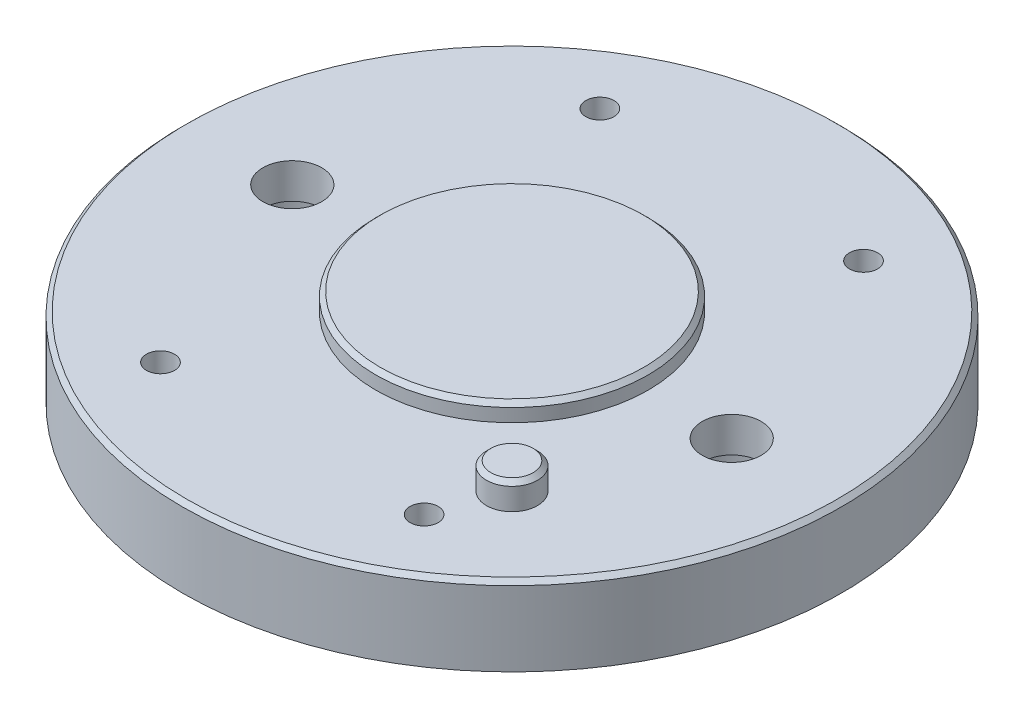
from build123d import *

# Parameters (mm, degrees)
SKIZZE1_R                       = 37.5
SKIZZE1_R_2                     = 3.25
AUFSATZ_LINEAR_AUSTRAGEN1_DEPTH = 9
BOHRUNG1_D                      = 6.7
BOHRUNG1_CBORE_D                = 11.1
BOHRUNG1_CBORE_DEPTH            = 5
SKIZZE3_R                       = 15.5
AUFSATZ_LINEAR_AUSTRAGEN2_DEPTH = 2
FASE1_SIZE                      = 0.5
SKIZZE7_R                       = 1.6
SCHNITT_LINEAR_AUSTRAGEN2_DEPTH = 55.161794653
FASE2_SIZE                      = 0.5
SKIZZE5_R                       = 2.9
AUFSATZ_LINEAR_AUSTRAGEN3_DEPTH = 3
FASE4_SIZE                      = 0.5


with BuildPart() as part:
    # Skizze1 → Aufsatz-Linear austragen1 (new body)
    with BuildSketch(Plane(origin=(0, 0, 0), x_dir=(1, 0, 0), z_dir=(0, 1, 0))):
        with Locations(Location((0, 0, 0), (0, 0, 270))):
            Circle(SKIZZE1_R)
        with Locations(Location((-25, 0, 0), (0, 0, 270))):
            Circle(SKIZZE1_R_2, mode=Mode.SUBTRACT)
        with Locations(Location((25, 0, 0), (0, 0, 270))):
            Circle(SKIZZE1_R_2, mode=Mode.SUBTRACT)
    extrude(amount=AUFSATZ_LINEAR_AUSTRAGEN1_DEPTH)

    # Bohrung1 (through all)
    with Locations(Plane(origin=(25, 0, 0), x_dir=(0, 0, -1), z_dir=(0, -1, 0))):
        with Locations((0, 0), (0, -50)):
            CounterBoreHole(BOHRUNG1_D / 2, BOHRUNG1_CBORE_D / 2, BOHRUNG1_CBORE_DEPTH)

    # Skizze3 → Aufsatz-Linear austragen2 (add)
    with BuildSketch(Plane(origin=(0, 9, 0), x_dir=(-1, 0, 0), z_dir=(0, 1, 0))):
        with Locations(Location((0, 0, 0), (0, 0, 90))):
            Circle(SKIZZE3_R)
    extrude(amount=AUFSATZ_LINEAR_AUSTRAGEN2_DEPTH)

    # Fase1
    fase1_edges = [part.edges().sort_by_distance(p)[0] for p in [
        (0, 11, -15.5),
    ]]
    chamfer(fase1_edges, length=FASE1_SIZE)

    # Skizze7 → Schnitt-Linear austragen2 (cut, through all)
    with BuildSketch(Plane(origin=(0, 0, 0), x_dir=(-1, 0, 0), z_dir=(0, -1, 0))):
        with Locations(Location((-15, 25, 0), (0, 0, 90))):
            Circle(SKIZZE7_R)
        with Locations(Location((15, 25, 0), (0, 0, 90))):
            Circle(SKIZZE7_R)
        with Locations(Location((15, -25, 0), (0, 0, 90))):
            Circle(SKIZZE7_R)
        with Locations(Location((-15, -25, 0), (0, 0, 90))):
            Circle(SKIZZE7_R)
    extrude(amount=-SCHNITT_LINEAR_AUSTRAGEN2_DEPTH, mode=Mode.SUBTRACT)

    # Fase2
    fase2_edges = [part.edges().sort_by_distance(p)[0] for p in [
        (0, 9, -37.5),
    ]]
    chamfer(fase2_edges, length=FASE2_SIZE)

    # Skizze5 → Aufsatz-Linear austragen3 (add)
    with BuildSketch(Plane(origin=(0, 9, 0), x_dir=(-1, 0, 0), z_dir=(0, 1, 0))):
        with Locations(Location((-17.67766953, 17.67766953, 0), (0, 0, 90))):
            Circle(SKIZZE5_R)
    extrude(amount=AUFSATZ_LINEAR_AUSTRAGEN3_DEPTH)

    # Fase4
    fase4_edges = [part.edges().sort_by_distance(p)[0] for p in [
        (17.67766953, 12, 14.77766953),
    ]]
    chamfer(fase4_edges, length=FASE4_SIZE)


solid = part.part
